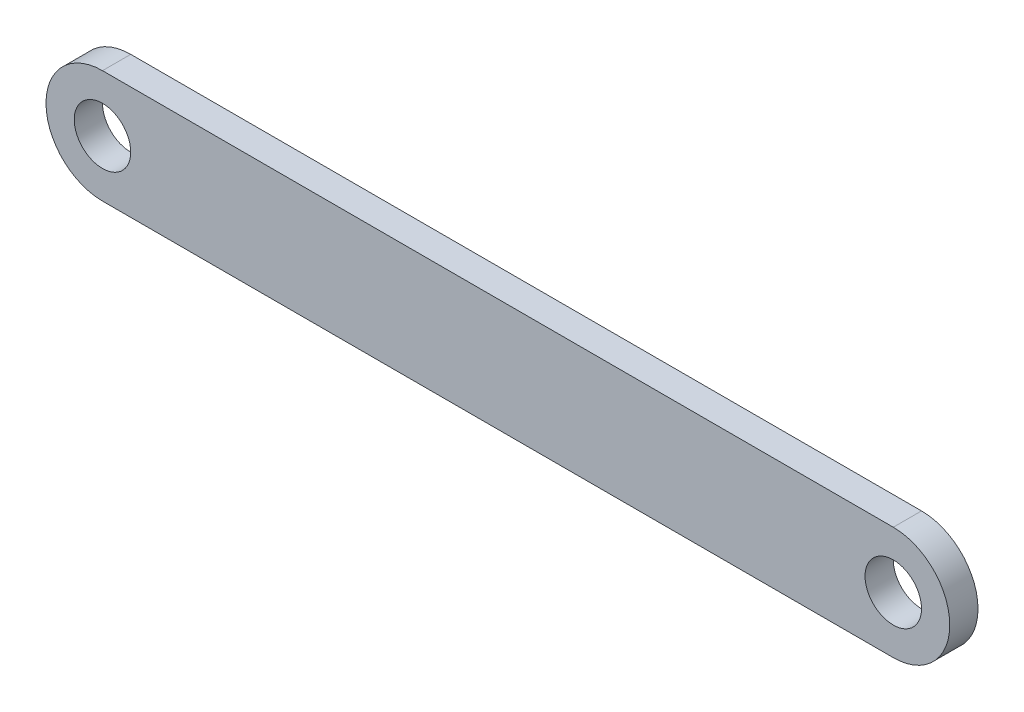
from build123d import *

# Parameters (mm, degrees)
CROQUIS1_R              = 5
SALIENTE_EXTRUIR1_DEPTH = 5


with BuildPart() as part:
    # Croquis1 → Saliente-Extruir1 (new body)
    with BuildSketch(Plane.XY):
        with BuildLine():
            Line((-70, 10), (70, 10))
            ThreePointArc((70, 10), (80, 0), (70, -10))
            Line((70, -10), (-70, -10))
            ThreePointArc((-70, -10), (-80, 0), (-70, 10))
        make_face()
        with Locations((70, 0)):
            Circle(CROQUIS1_R, mode=Mode.SUBTRACT)
        with Locations((-70, 0)):
            Circle(CROQUIS1_R, mode=Mode.SUBTRACT)
    extrude(amount=SALIENTE_EXTRUIR1_DEPTH)


solid = part.part
